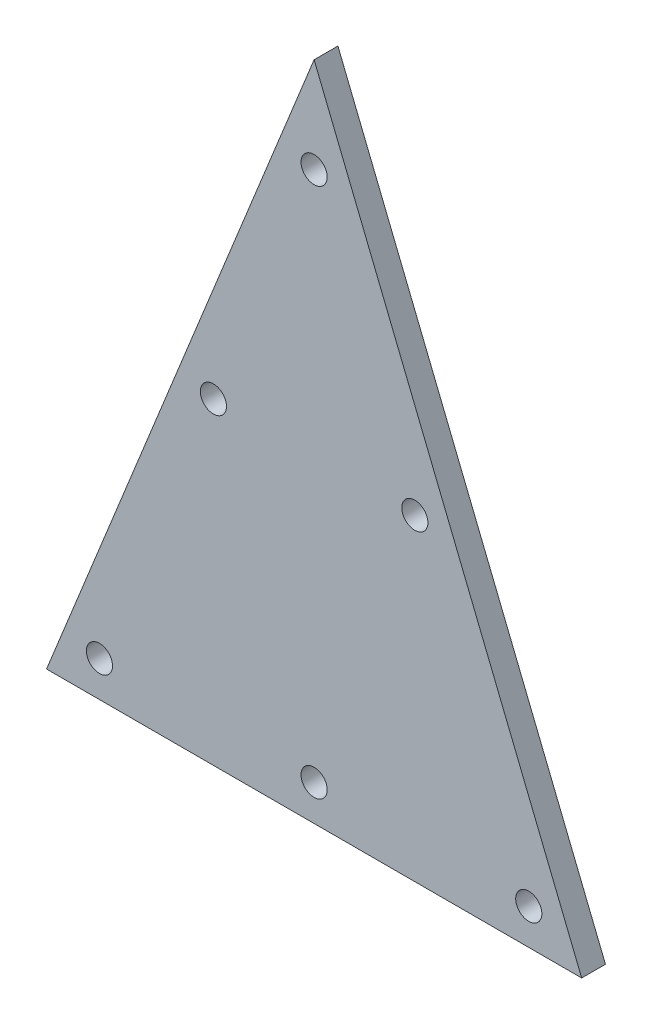
from build123d import *

# Parameters (mm, degrees)
ESQUISSE1_R        = 1.1
BOSS_EXTRU_1_DEPTH = 2


with BuildPart() as part:
    # Esquisse1 → Boss.-Extru.1 (new body)
    with BuildSketch(Plane.XY):
        Polygon((0, 0), (45, 0), (22.5, 55.621488653), align=None)
        with Locations((22.5, 3)):
            Circle(ESQUISSE1_R, mode=Mode.SUBTRACT)
        with Locations((14.031074433, 26.685744327)):
            Circle(ESQUISSE1_R, mode=Mode.SUBTRACT)
        with Locations((30.968925567, 26.685744327)):
            Circle(ESQUISSE1_R, mode=Mode.SUBTRACT)
        with Locations((4.449719092, 3)):
            Circle(ESQUISSE1_R, mode=Mode.SUBTRACT)
        with Locations((22.5, 47.621488653)):
            Circle(ESQUISSE1_R, mode=Mode.SUBTRACT)
        with Locations((40.550280908, 3)):
            Circle(ESQUISSE1_R, mode=Mode.SUBTRACT)
    extrude(amount=BOSS_EXTRU_1_DEPTH)


solid = part.part
